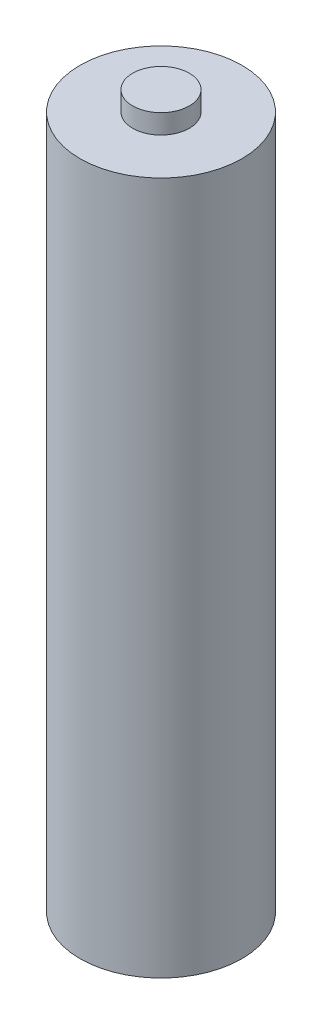
from build123d import *

# Parameters (mm, degrees)
SKETCH_1_W = 1.75
SKETCH_1_H = 1.2


with BuildPart() as part:
    # 草图1 → 旋转1 (revolve)
    with BuildSketch(Plane(origin=(0, 0, 0), x_dir=(0, 0, -1), z_dir=(1, 0, 0)), mode=Mode.PRIVATE) as revolve_1_sk:
        with Locations((0.875, 0.6)):
            Rectangle(SKETCH_1_W, SKETCH_1_H)
        Polygon((1.75, 0), (0, 0), (0, -42.8), (5, -42.8), (5, 0), align=None)
    revolve(revolve_1_sk.sketch.rotate(Axis((0, 0, 0), (0, -1, 0)), 180), axis=Axis((0, 0, 0), (0, -1, 0)))


solid = part.part
